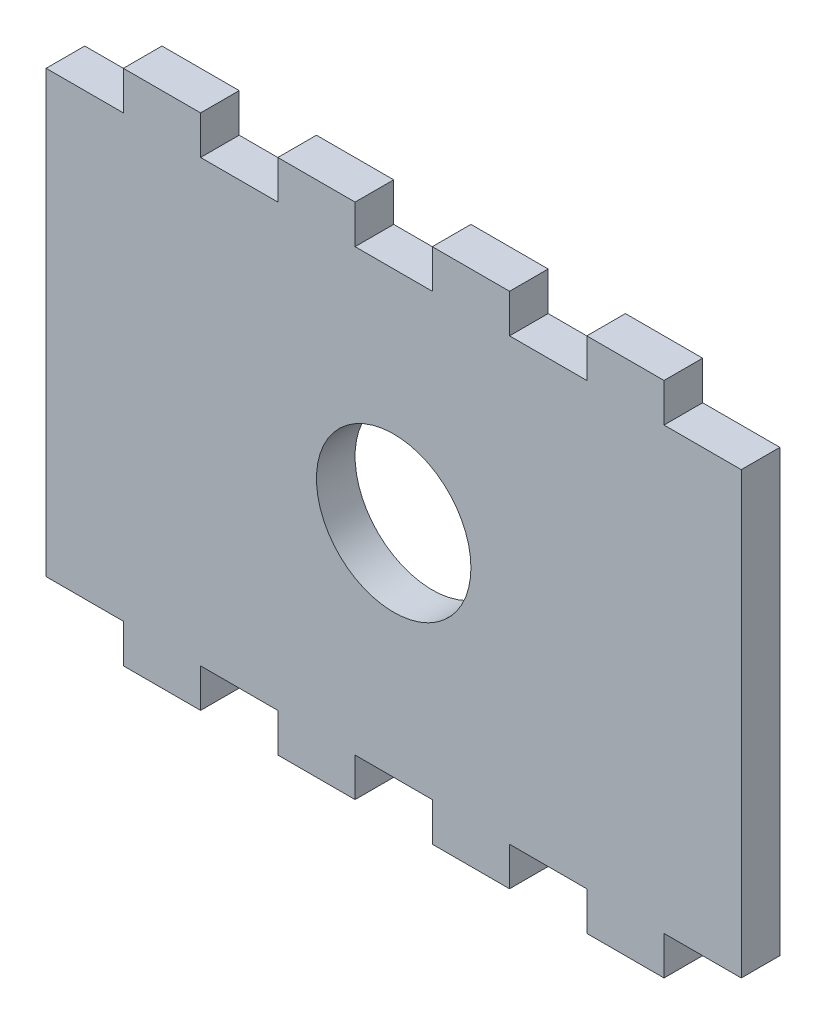
from build123d import *

# Parameters (mm, degrees)
SKETCH1_R           = 6.35
BOSS_EXTRUDE1_DEPTH = 3.175


with BuildPart() as part:
    # Sketch1 → Boss-Extrude1 (new body)
    with BuildSketch(Plane.XY):
        Polygon((6.35, 0), (6.35, -3.175), (12.7, -3.175), (12.7, 0), (19.05, 0), (19.05, -3.175), (25.4, -3.175), (25.4, 0), (31.75, 0), (31.75, -3.175), (38.1, -3.175), (38.1, 0), (44.45, 0), (44.45, -3.175), (50.8, -3.175), (50.8, 0), (57.15, 0), (57.15, 36.195), (50.8, 36.195), (50.8, 39.37), (44.45, 39.37), (44.45, 36.195), (38.1, 36.195), (38.1, 39.37), (31.75, 39.37), (31.75, 36.195), (25.4, 36.195), (25.4, 39.37), (19.05, 39.37), (19.05, 36.195), (12.7, 36.195), (12.7, 39.37), (6.35, 39.37), (6.35, 36.195), (0, 36.195), (0, 0), align=None)
        with Locations((28.575, 18.0975)):
            Circle(SKETCH1_R, mode=Mode.SUBTRACT)
    extrude(amount=BOSS_EXTRUDE1_DEPTH)


solid = part.part
